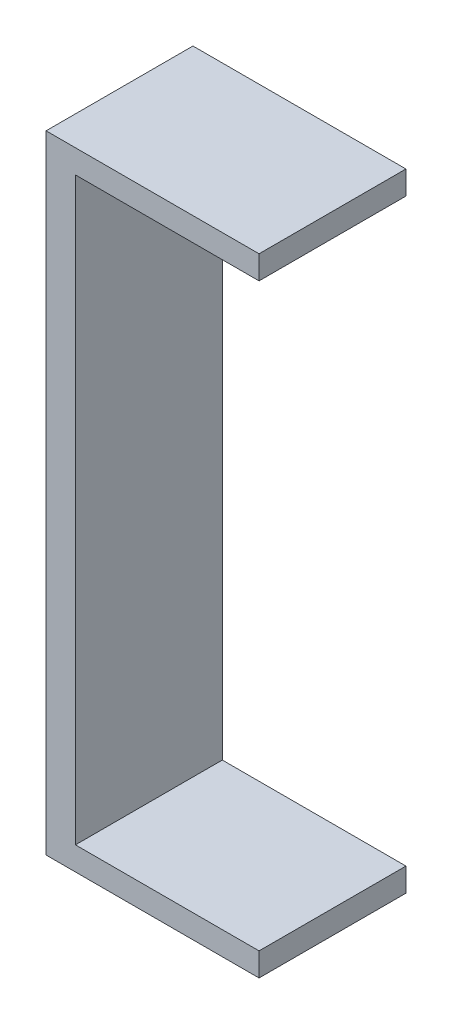
from build123d import *

# Parameters (mm, degrees)
BOSS_EXTRUDE1_DEPTH = 12.7


with BuildPart() as part:
    # Sketch1 → Boss-Extrude1 (new body)
    with BuildSketch(Plane.XY):
        Polygon((18.415, 54.229), (0, 54.229), (0, 0), (18.415, 0), (18.415, 2.032), (2.54, 2.032), (2.54, 52.197), (18.415, 52.197), align=None)
    extrude(amount=BOSS_EXTRUDE1_DEPTH)


solid = part.part
